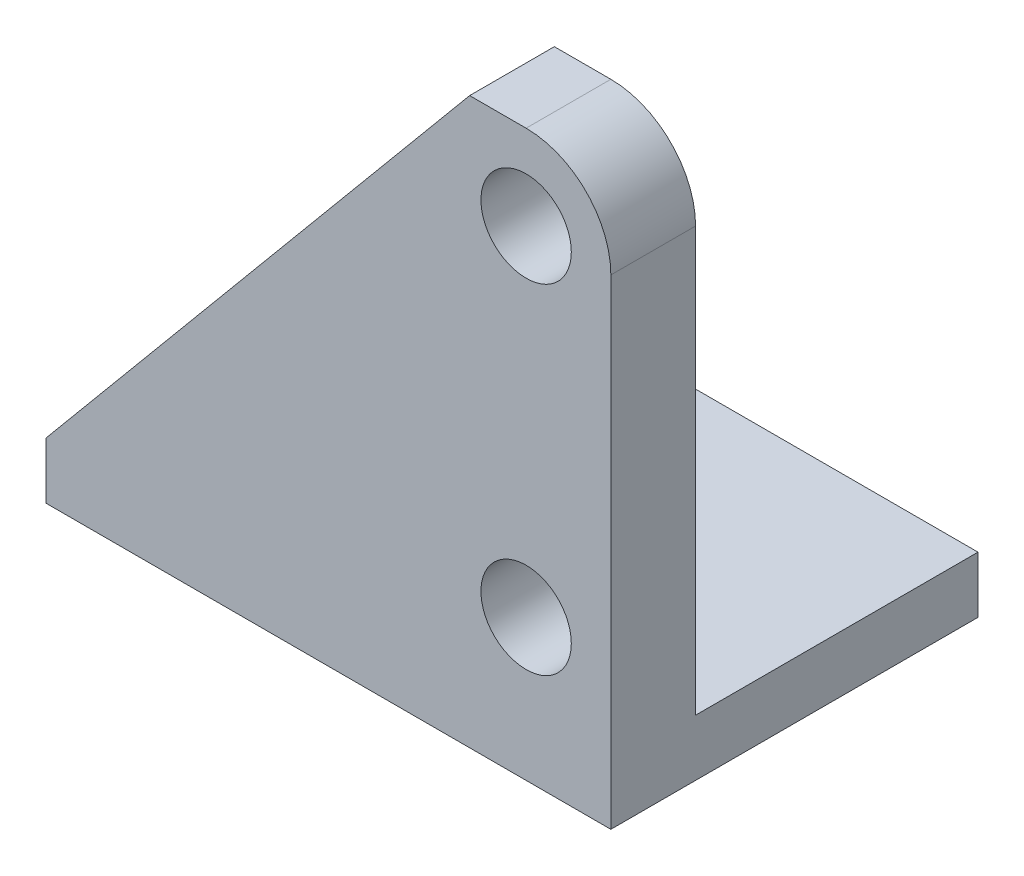
from build123d import *

# Parameters (mm, degrees)
SKETCH_1_R          = 1.6
EXTRUDE_1_DEPTH     = 3
SKETCH_2_W          = 20
SKETCH_2_H          = 2
EXTRUDE_2_DEPTH     = 13
CUT_EXTRUDE_1_DEPTH = 20


with BuildPart() as part:
    # 草图1 → 凸台-拉伸1 (new body)
    with BuildSketch(Plane.XY):
        with BuildLine():
            Line((0, 0), (20, 0))
            Line((20, 0), (20, 17))
            ThreePointArc((20, 17), (19.121320344, 19.121320344), (17, 20))
            Line((17, 20), (0, 20))
            Line((0, 20), (0, 0))
        make_face()
        with Locations((17, 17)):
            Circle(SKETCH_1_R, mode=Mode.SUBTRACT)
        with Locations((17, 5)):
            Circle(SKETCH_1_R, mode=Mode.SUBTRACT)
    extrude(amount=EXTRUDE_1_DEPTH)

    # 草图2 → 凸台-拉伸2 (add)
    with BuildSketch(Plane.XY.offset(3)):
        with Locations((10, 1)):
            Rectangle(SKETCH_2_W, SKETCH_2_H)
    extrude(amount=-EXTRUDE_2_DEPTH)

    # 草图3 → 切除-拉伸1 (cut)
    with BuildSketch(Plane.XY.offset(3)):
        Polygon((0, 2), (15, 20), (0, 20), align=None)
    extrude(amount=-CUT_EXTRUDE_1_DEPTH, mode=Mode.SUBTRACT)


solid = part.part
